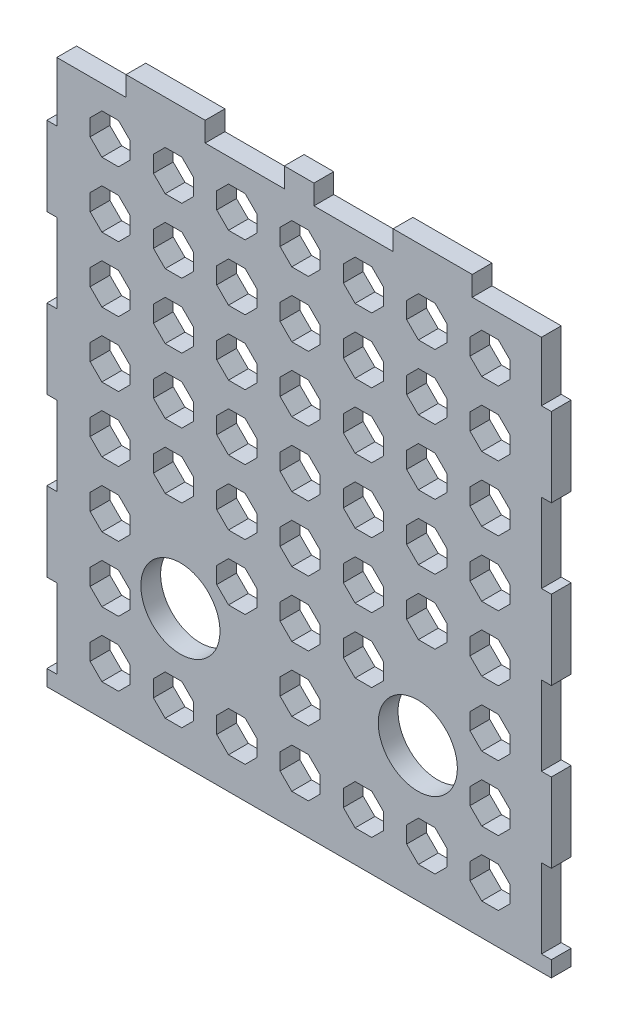
from build123d import *

# Parameters (mm, degrees)
SKETCH1_W               = 80.9625
SKETCH1_H               = 91.44
BOSS_EXTRUDE1_DEPTH     = 3.175
SKETCH2_W               = 1.5875
SKETCH2_H               = 12.7
CUT_EXTRUDE1_DEPTH      = 123.173158391
LPATTERN1_COUNT         = 5
LPATTERN1_PITCH         = 25.4
SKETCH5_W               = 12.7
SKETCH5_H               = 3.175
CUT_EXTRUDE2_DEPTH      = 123.173158391
LPATTERN2_COUNT         = 2
LPATTERN2_PITCH         = 25.4
HOLE1_D                 = 12.7
HOLE1_DEPTH             = 93.98
MIRROR1_COPY_1_SKETCH_W = 1.5875
MIRROR1_COPY_1_SKETCH_H = 12.7
MIRROR1_COPY_1_DEPTH    = 123.173158391
MIRROR1_COPY_2_SKETCH_W = 1.5875
MIRROR1_COPY_2_SKETCH_H = 12.7
MIRROR1_COPY_2_DEPTH    = 123.173158391
MIRROR1_COPY_3_SKETCH_W = 1.5875
MIRROR1_COPY_3_SKETCH_H = 12.7
MIRROR1_COPY_3_DEPTH    = 123.173158391
MIRROR1_COPY_4_SKETCH_W = 1.5875
MIRROR1_COPY_4_SKETCH_H = 12.7
MIRROR1_COPY_4_DEPTH    = 123.173158391
MIRROR1_COPY_5_SKETCH_W = 12.7
MIRROR1_COPY_5_SKETCH_H = 3.175
MIRROR1_COPY_5_DEPTH    = 123.173158391
CUT_EXTRUDE3_DEPTH      = 123.173158391
LPATTERN6_COUNT         = 7
LPATTERN6_PITCH         = 10.16
LPATTERN6_COUNT_DIR2    = 8
LPATTERN6_PITCH_DIR2    = 10.414


with BuildPart() as part:
    # Sketch1 → Boss-Extrude1 (new body)
    with BuildSketch(Plane.XY):
        with Locations((40.48125, -45.72)):
            Rectangle(SKETCH1_W, SKETCH1_H)
    extrude(amount=BOSS_EXTRUDE1_DEPTH)

    # Sketch2 → Cut-Extrude1 (cut, through all)
    with BuildSketch(Plane.XY.offset(3.175)):
        with Locations((0.79375, -6.35)):
            Rectangle(SKETCH2_W, SKETCH2_H)
    cut_extrude1 = extrude(amount=-CUT_EXTRUDE1_DEPTH, mode=Mode.SUBTRACT)

    # LPattern1: Cut-Extrude1 ×5
    with Locations(*[(0, -i * LPATTERN1_PITCH, 0) for i in range(1, LPATTERN1_COUNT)]):
        add(cut_extrude1, mode=Mode.SUBTRACT)

    # Sketch5 → Cut-Extrude2 (cut, through all)
    with BuildSketch(Plane.XY.offset(3.175)):
        with Locations((6.35, -1.5875)):
            Rectangle(SKETCH5_W, SKETCH5_H)
    cut_extrude2 = extrude(amount=-CUT_EXTRUDE2_DEPTH, mode=Mode.SUBTRACT)

    # LPattern2: Cut-Extrude2 ×2
    with Locations(*[(i * LPATTERN2_PITCH, 0, 0) for i in range(1, LPATTERN2_COUNT)]):
        add(cut_extrude2, mode=Mode.SUBTRACT)

    # Hole1
    with Locations(Plane.XY.offset(3.175)):
        with Locations((21.43125, -69.85)):
            hole1 = Hole(HOLE1_D / 2, depth=HOLE1_DEPTH)

    # Mirror1: Cut-Extrude1, Cut-Extrude2, Hole1 across plane
    add(cut_extrude1.mirror(Plane(origin=(40.48125, 0, 0), x_dir=(0, 0, 1), z_dir=(1, 0, 0))), mode=Mode.SUBTRACT)
    add(cut_extrude2.mirror(Plane(origin=(40.48125, 0, 0), x_dir=(0, 0, 1), z_dir=(1, 0, 0))), mode=Mode.SUBTRACT)
    add(hole1.mirror(Plane(origin=(40.48125, 0, 0), x_dir=(0, 0, 1), z_dir=(1, 0, 0))), mode=Mode.SUBTRACT)

    # Mirror1 copy 1 sketch → Mirror1 copy 1 (cut, through all)
    with BuildSketch(Plane(origin=(80.9625, -25.4, 3.175), x_dir=(-1, 0, 0), z_dir=(0, 0, 1))):
        with Locations((0.79375, 6.35)):
            Rectangle(MIRROR1_COPY_1_SKETCH_W, MIRROR1_COPY_1_SKETCH_H)
    extrude(amount=-MIRROR1_COPY_1_DEPTH, mode=Mode.SUBTRACT)

    # Mirror1 copy 2 sketch → Mirror1 copy 2 (cut, through all)
    with BuildSketch(Plane(origin=(80.9625, -50.8, 3.175), x_dir=(-1, 0, 0), z_dir=(0, 0, 1))):
        with Locations((0.79375, 6.35)):
            Rectangle(MIRROR1_COPY_2_SKETCH_W, MIRROR1_COPY_2_SKETCH_H)
    extrude(amount=-MIRROR1_COPY_2_DEPTH, mode=Mode.SUBTRACT)

    # Mirror1 copy 3 sketch → Mirror1 copy 3 (cut, through all)
    with BuildSketch(Plane(origin=(80.9625, -76.2, 3.175), x_dir=(-1, 0, 0), z_dir=(0, 0, 1))):
        with Locations((0.79375, 6.35)):
            Rectangle(MIRROR1_COPY_3_SKETCH_W, MIRROR1_COPY_3_SKETCH_H)
    extrude(amount=-MIRROR1_COPY_3_DEPTH, mode=Mode.SUBTRACT)

    # Mirror1 copy 4 sketch → Mirror1 copy 4 (cut, through all)
    with BuildSketch(Plane(origin=(80.9625, -101.6, 3.175), x_dir=(-1, 0, 0), z_dir=(0, 0, 1))):
        with Locations((0.79375, 6.35)):
            Rectangle(MIRROR1_COPY_4_SKETCH_W, MIRROR1_COPY_4_SKETCH_H)
    extrude(amount=-MIRROR1_COPY_4_DEPTH, mode=Mode.SUBTRACT)

    # Mirror1 copy 5 sketch → Mirror1 copy 5 (cut, through all)
    with BuildSketch(Plane(origin=(55.5625, 0, 3.175), x_dir=(-1, 0, 0), z_dir=(0, 0, 1))):
        with Locations((6.35, 1.5875)):
            Rectangle(MIRROR1_COPY_5_SKETCH_W, MIRROR1_COPY_5_SKETCH_H)
    extrude(amount=-MIRROR1_COPY_5_DEPTH, mode=Mode.SUBTRACT)

    # Sketch10 → Cut-Extrude3 (cut, through all)
    with BuildSketch(Plane.XY.offset(3.175)):
        Polygon((13.379353785, -8.870853785), (11.4935, -6.985), (8.8265, -6.985), (6.940646215, -8.870853785), (6.940646215, -11.537853785), (8.8265, -13.423707571), (11.4935, -13.423707571), (13.379353785, -11.537853785), align=None)
    cut_extrude3 = extrude(amount=-CUT_EXTRUDE3_DEPTH, mode=Mode.SUBTRACT)

    # LPattern6: Cut-Extrude3 7 × 8, 6 skipped
    with Locations(*[(i * LPATTERN6_PITCH, -j * LPATTERN6_PITCH_DIR2, 0) for i in range(LPATTERN6_COUNT) for j in range(LPATTERN6_COUNT_DIR2) if (i, j) not in ((0, 0), (1, 5), (1, 6), (2, 6), (4, 6), (5, 5), (5, 6))]):
        add(cut_extrude3, mode=Mode.SUBTRACT)


solid = part.part
